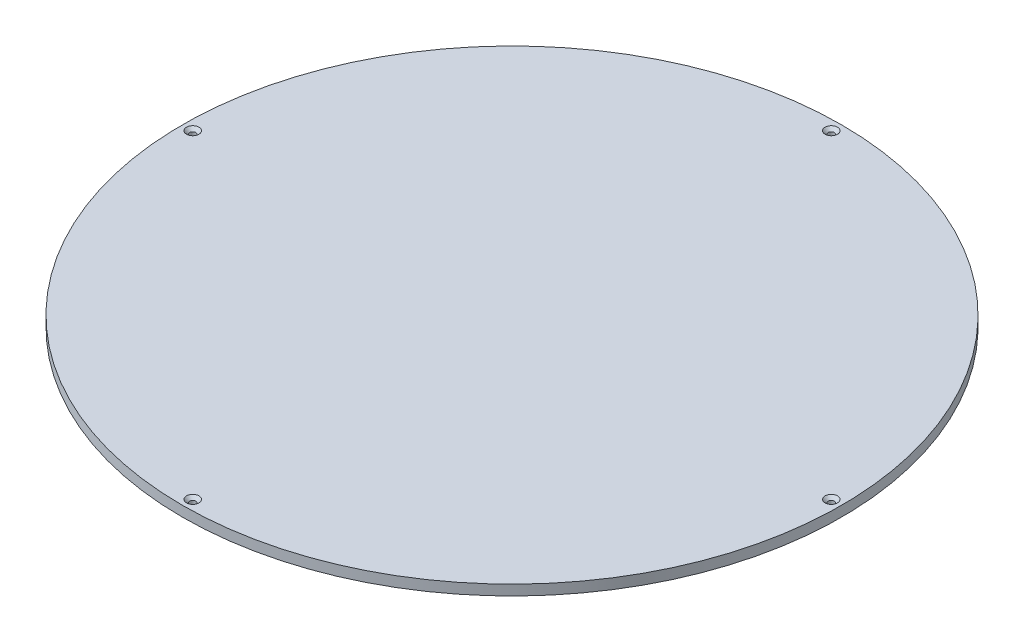
from build123d import *

# Parameters (mm, degrees)
SKETCH1_R           = 160
SKETCH1_R_2         = 1.5
BOSS_EXTRUDE1_DEPTH = 5
CHAMFER1_SIZE       = 1.5


with BuildPart() as part:
    # Sketch1 → Boss-Extrude1 (new body)
    with BuildSketch(Plane(origin=(0, 0, 0), x_dir=(1, 0, 0), z_dir=(0, 1, 0))):
        with Locations(Location((0, 0, 0), (0, 0, 270))):
            Circle(SKETCH1_R)
        with Locations(Location((155, 0, 0), (0, 0, 270))):
            Circle(SKETCH1_R_2, mode=Mode.SUBTRACT)
        with Locations(Location((0, -155, 0), (0, 0, 270))):
            Circle(SKETCH1_R_2, mode=Mode.SUBTRACT)
        with Locations(Location((-155, 0, 0), (0, 0, 270))):
            Circle(SKETCH1_R_2, mode=Mode.SUBTRACT)
        with Locations(Location((0, 155, 0), (0, 0, 270))):
            Circle(SKETCH1_R_2, mode=Mode.SUBTRACT)
    extrude(amount=-BOSS_EXTRUDE1_DEPTH)

    # Chamfer1
    chamfer1_edges = [part.edges().sort_by_distance(p)[0] for p in [
        (-155, 0, -1.5),
        (0, 0, -156.5),
        (155, 0, -1.5),
        (0, 0, 153.5),
    ]]
    chamfer(chamfer1_edges, length=CHAMFER1_SIZE)


solid = part.part
